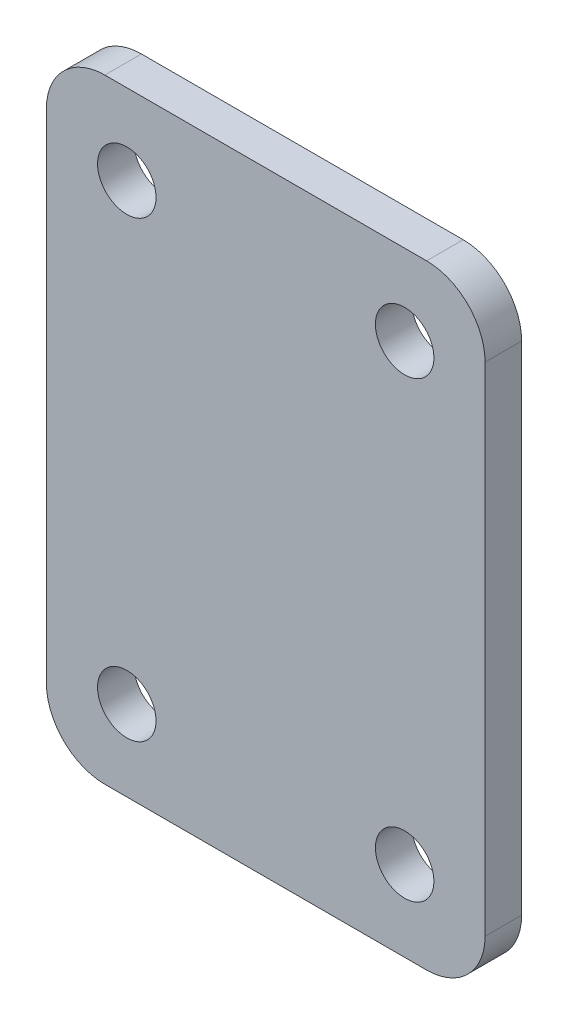
from build123d import *

# Parameters (mm, degrees)
SKETCH2_W               = 138
SKETCH2_H               = 42
SKETCH2_R               = 2
SKETCH2_R_2             = 3.5
SKETCH2_R_3             = 8.5
BOSS_EXTRUDE1_DEPTH     = 2.38125
SKETCH3_R               = 4
SKETCH3_R_2             = 2
CUT_EXTRUDE1_DEPTH      = 4
SKETCH4_R               = 3.175
SKETCH4_R_2             = 2
BOSS_EXTRUDE2_DEPTH     = 17.9
SKETCH6_R               = 2
CUT_EXTRUDE2_DEPTH      = 10
BOSS_EXTRUDE3_DEPTH     = 4.7625
SKETCH7_R               = 3.175
BOSS_EXTRUDE4_DEPTH     = 17.9
FILLET1_R               = 6.35
BOSS_EXTRUDE5_START     = -27.425
BOSS_EXTRUDE5_DEPTH     = 27.425
CUT_EXTRUDE4_START      = -4
SKETCH9_R               = 4
CUT_EXTRUDE4_DEPTH      = 4
SKETCH10_R              = 11.00455
CUT_EXTRUDE5_DEPTH      = 2.5
CUT_EXTRUDE6_DEPTH      = 123.578796086
CUT_EXTRUDE6_DEPTH_BACK = 123.578796086
SKETCH11_R              = 1.65
SKETCH12_R              = 2
BOSS_EXTRUDE6_DEPTH     = 2.5


with BuildPart() as part:
    # Sketch2 → Boss-Extrude1 (new, symmetric)
    with BuildSketch(Plane.XY):
        with Locations((48, 0)):
            Rectangle(SKETCH2_W, SKETCH2_H)
        with Locations(Location((34, -15.5, 0), (0, 0, 180))):
            Circle(SKETCH2_R, mode=Mode.SUBTRACT)
        with Locations(Location((34, 15.5, 0), (0, 0, 180))):
            Circle(SKETCH2_R, mode=Mode.SUBTRACT)
        with Locations(Location((0, 0, 0), (0, 0, 180))):
            Circle(SKETCH2_R_2, mode=Mode.SUBTRACT)
        with Locations(Location((60, 0, 0), (0, 0, 180))):
            Circle(SKETCH2_R_3, mode=Mode.SUBTRACT)
    boss_extrude1 = extrude(amount=BOSS_EXTRUDE1_DEPTH, both=True)

    # Sketch3 → Cut-Extrude1 (cut)
    # profile 1 of 6: a face of its own
    with BuildSketch(Plane(origin=(0, 0, -2.38125), x_dir=(-1, 0, 0), z_dir=(0, 0, -1))):
        with Locations((-34, -15.5)):
            Circle(SKETCH3_R)
    # profile 2 of 6: a face of its own
    with BuildSketch(Plane(origin=(0, 0, -2.38125), x_dir=(-1, 0, 0), z_dir=(0, 0, -1))):
        with Locations((-34, 15.5)):
            Circle(SKETCH3_R)
        with Locations((-34, 15.5)):
            Circle(SKETCH3_R_2, mode=Mode.SUBTRACT)
    # profile 3 of 6: a face of its own
    with BuildSketch(Plane(origin=(0, 0, -2.38125), x_dir=(-1, 0, 0), z_dir=(0, 0, -1))):
        with Locations((-15.5, 15.5)):
            Circle(SKETCH3_R)
    # profile 4 of 6: a face of its own
    with BuildSketch(Plane(origin=(0, 0, -2.38125), x_dir=(-1, 0, 0), z_dir=(0, 0, -1))):
        with Locations((15.5, 15.5)):
            Circle(SKETCH3_R)
    # profile 5 of 6: a face of its own
    with BuildSketch(Plane(origin=(0, 0, -2.38125), x_dir=(-1, 0, 0), z_dir=(0, 0, -1))):
        with Locations((-15.5, -15.5)):
            Circle(SKETCH3_R)
    # profile 6 of 6: a face of its own
    with BuildSketch(Plane(origin=(0, 0, -2.38125), x_dir=(-1, 0, 0), z_dir=(0, 0, -1))):
        with Locations((15.5, -15.5)):
            Circle(SKETCH3_R)
    extrude(amount=-CUT_EXTRUDE1_DEPTH, mode=Mode.SUBTRACT)

    # Sketch4 → Boss-Extrude2 (add)
    # profile 1 of 2: a face of its own
    with BuildSketch(Plane(origin=(0, 0, -2.38125), x_dir=(-1, 0, 0), z_dir=(0, 0, -1))):
        with Locations(Location((-111.5, -15.5, 0), (0, 0, 180))):
            Circle(SKETCH4_R)
        with Locations(Location((-111.5, -15.5, 0), (0, 0, 180))):
            Circle(SKETCH4_R_2, mode=Mode.SUBTRACT)
    # profile 2 of 2: a face of its own
    with BuildSketch(Plane(origin=(0, 0, -2.38125), x_dir=(-1, 0, 0), z_dir=(0, 0, -1))):
        with Locations(Location((-111.5, 15.5, 0), (0, 0, 180))):
            Circle(SKETCH4_R)
        with Locations(Location((-111.5, 15.5, 0), (0, 0, 180))):
            Circle(SKETCH4_R_2, mode=Mode.SUBTRACT)
    extrude(amount=BOSS_EXTRUDE2_DEPTH)

    # Sketch6 → Cut-Extrude2 (cut)
    with BuildSketch(Plane(origin=(0, 0, -2.38125), x_dir=(-1, 0, 0), z_dir=(0, 0, -1))):
        with Locations((-15.5, 15.5)):
            Circle(SKETCH6_R)
        with Locations((15.5, 15.5)):
            Circle(SKETCH6_R)
        with Locations((15.5, -15.5)):
            Circle(SKETCH6_R)
        with Locations((-15.5, -15.5)):
            Circle(SKETCH6_R)
    extrude(amount=-CUT_EXTRUDE2_DEPTH, mode=Mode.SUBTRACT)

    # Sketch5 → Boss-Extrude3 (add)
    with BuildSketch(Plane(origin=(0, 0, -2.38125), x_dir=(-1, 0, 0), z_dir=(0, 0, -1))):
        with BuildLine():
            Line((21, -21), (27.208091957, -0.938604379))
            ThreePointArc((27.208091957, -0.938604379), (27.35, 0), (27.208091957, 0.938604379))
            Line((27.208091957, 0.938604379), (21, 21))
            Line((21, 21), (21, -21))
        make_face()
    boss_extrude3 = extrude(amount=-BOSS_EXTRUDE3_DEPTH)

    # Mirror2: Boss-Extrude1, Boss-Extrude3 across plane
    add(boss_extrude1.mirror(Plane(origin=(0, 0, -11.33125), x_dir=(1, 0, 0), z_dir=(0, 0, -1))))
    add(boss_extrude3.mirror(Plane(origin=(0, 0, -11.33125), x_dir=(1, 0, 0), z_dir=(0, 0, -1))))

    # Sketch7 → Boss-Extrude4 (add)
    with BuildSketch(Plane.XY.offset(-20.28125)):
        with Locations(Location((-24.175, 0, 0), (0, 0, 197.194924512))):
            Circle(SKETCH7_R)
    extrude(amount=BOSS_EXTRUDE4_DEPTH)

    # Fillet1
    fillet1_edges = [part.edges().sort_by_distance(p)[0] for p in [
        (117, 21, -22.6625),
        (117, -21, -22.6625),
        (-21, -21, -22.6625),
        (-21, 21, -22.6625),
        (117, -21, 0),
        (-21, -21, 0),
        (-21, 21, 0),
        (117, 21, 0),
    ]]
    fillet(fillet1_edges, radius=FILLET1_R)

    # Sketch8 → Boss-Extrude5 (add)
    with BuildSketch(Plane(origin=(0, 0, -25.04375), x_dir=(-1, 0, 0), z_dir=(0, 0, -1)).offset(BOSS_EXTRUDE5_START)):
        with BuildLine():
            ThreePointArc((3.175, 21), (0, 24.175), (-3.175, 21))
            Line((-3.175, 21), (3.175, 21))
        make_face()
        with BuildLine():
            Line((3.175, -21), (-3.175, -21))
            ThreePointArc((-3.175, -21), (0, -24.175), (3.175, -21))
        make_face()
    extrude(amount=BOSS_EXTRUDE5_DEPTH)

    # Sketch9 → Cut-Extrude4 (cut)
    with BuildSketch(Plane.XY.offset(-20.28125).offset(CUT_EXTRUDE4_START)):
        with Locations(Location((34, -15.5, 0), (0, 0, 180))):
            Circle(SKETCH9_R)
        with Locations(Location((34, 15.5, 0), (0, 0, 180))):
            Circle(SKETCH9_R)
    extrude(amount=CUT_EXTRUDE4_DEPTH, mode=Mode.SUBTRACT)

    # Sketch10 → Cut-Extrude5 (cut)
    with BuildSketch(Plane.XY.offset(2.38125)):
        Circle(SKETCH10_R)
    extrude(amount=-CUT_EXTRUDE5_DEPTH, mode=Mode.SUBTRACT)

    # Sketch11 → Cut-Extrude6 (cut, two sides: drawn at the far end of the back side and taken through both)
    with BuildSketch(Plane.XY.offset(2.38125).offset(-CUT_EXTRUDE6_DEPTH_BACK)):
        with Locations((50.5, 15.5)):
            Circle(SKETCH11_R)
        with Locations(Location((69.5, 15.5, 0), (0, 0, 180))):
            Circle(SKETCH11_R)
        with Locations((69.5, -15.5)):
            Circle(SKETCH11_R)
        with Locations(Location((50.5, -15.5, 0), (0, 0, 180))):
            Circle(SKETCH11_R)
    extrude(amount=CUT_EXTRUDE6_DEPTH + CUT_EXTRUDE6_DEPTH_BACK, mode=Mode.SUBTRACT)


with BuildPart() as body_2:
    # Sketch12 → Boss-Extrude6 (new body)
    with BuildSketch(Plane.XY.offset(2.38125)):
        with BuildLine():
            Line((49, 21), (71, 21))
            ThreePointArc((71, 21), (73.828427125, 19.828427125), (75, 17))
            Line((75, 17), (75, -17))
            ThreePointArc((75, -17), (73.828427125, -19.828427125), (71, -21))
            Line((71, -21), (49, -21))
            ThreePointArc((49, -21), (46.171572875, -19.828427125), (45, -17))
            Line((45, -17), (45, 17))
            ThreePointArc((45, 17), (46.171572875, 19.828427125), (49, 21))
        make_face()
        with Locations((50.5, 15.5)):
            Circle(SKETCH12_R, mode=Mode.SUBTRACT)
        with Locations(Location((69.5, 15.5, 0), (0, 0, 180))):
            Circle(SKETCH12_R, mode=Mode.SUBTRACT)
        with Locations((69.5, -15.5)):
            Circle(SKETCH12_R, mode=Mode.SUBTRACT)
        with Locations(Location((50.5, -15.5, 0), (0, 0, 180))):
            Circle(SKETCH12_R, mode=Mode.SUBTRACT)
    extrude(amount=BOSS_EXTRUDE6_DEPTH)


solid = body_2.part
